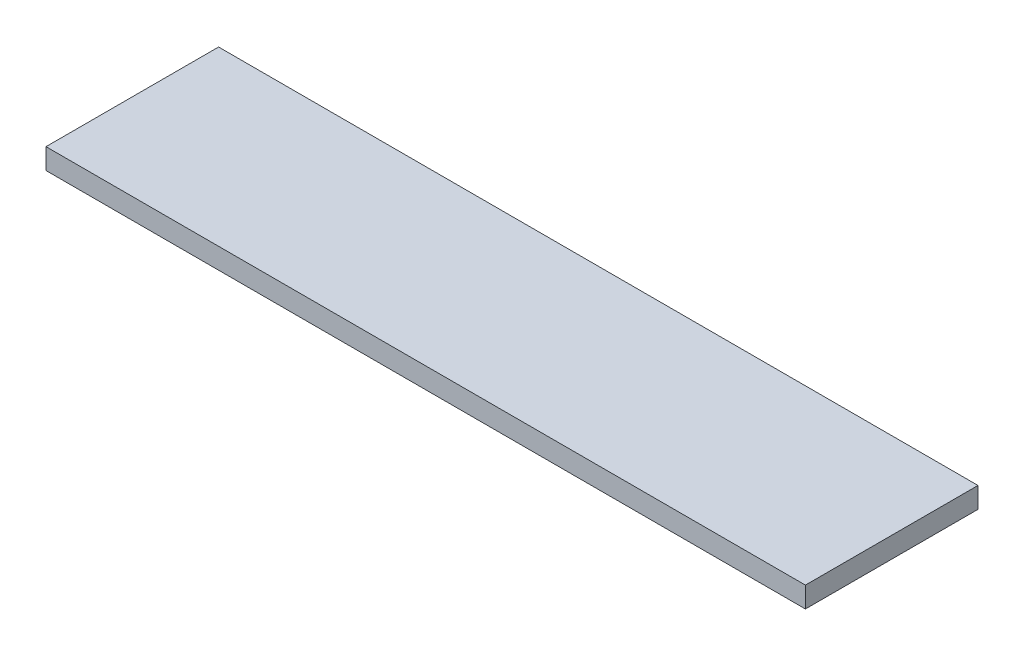
from build123d import *

# Parameters (mm, degrees)
SKETCH1_W           = 110
SKETCH1_H           = 25
BOSS_EXTRUDE1_DEPTH = 3


with BuildPart() as part:
    # Sketch1 → Boss-Extrude1 (new body)
    with BuildSketch(Plane(origin=(0, 0, 0), x_dir=(1, 0, 0), z_dir=(0, 1, 0))):
        Rectangle(SKETCH1_W, SKETCH1_H)
    extrude(amount=BOSS_EXTRUDE1_DEPTH)


solid = part.part
